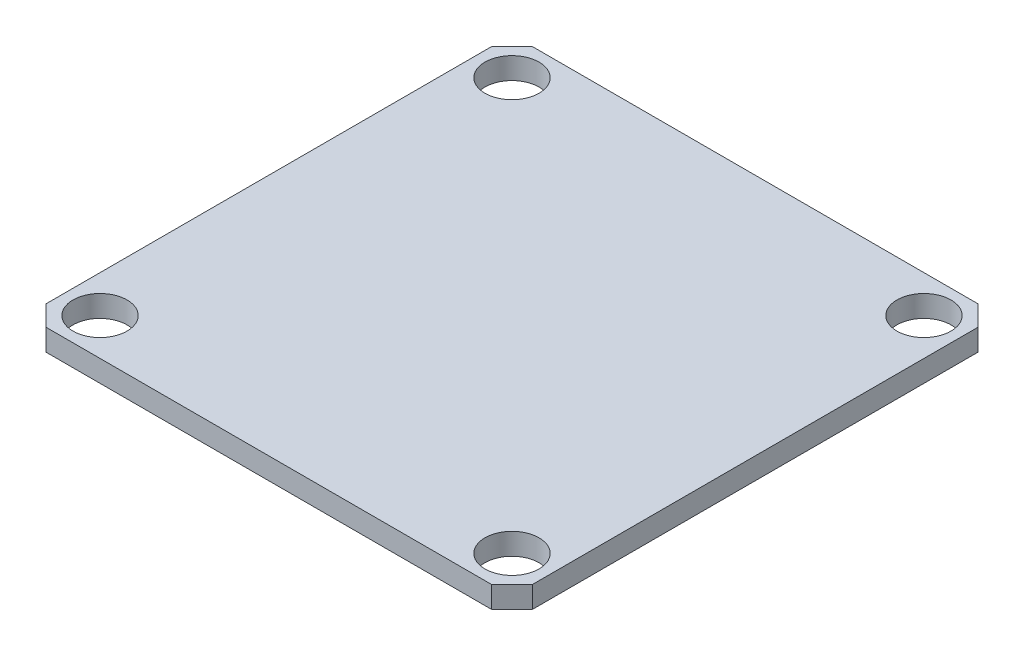
from build123d import *

# Parameters (mm, degrees)
SKETCH_1_R      = 2
EXTRUDE_1_DEPTH = 1.6


with BuildPart() as part:
    # 草图1 → 凸台-拉伸1 (new body)
    with BuildSketch(Plane(origin=(0, 0, 0), x_dir=(1, 0, 0), z_dir=(0, 1, 0))):
        Polygon((-16.5, -18), (16.5, -18), (18, -16.5), (18, 16.5), (16.5, 18), (-16.5, 18), (-18, 16.5), (-18, -16.5), align=None)
        with Locations(Location((15.25, 15.25, 0), (0, 0, 270))):
            Circle(SKETCH_1_R, mode=Mode.SUBTRACT)
        with Locations(Location((-15.25, 15.25, 0), (0, 0, 90))):
            Circle(SKETCH_1_R, mode=Mode.SUBTRACT)
        with Locations(Location((15.25, -15.25, 0), (0, 0, 90))):
            Circle(SKETCH_1_R, mode=Mode.SUBTRACT)
        with Locations(Location((-15.25, -15.25, 0), (0, 0, 270))):
            Circle(SKETCH_1_R, mode=Mode.SUBTRACT)
    extrude(amount=EXTRUDE_1_DEPTH)


solid = part.part
